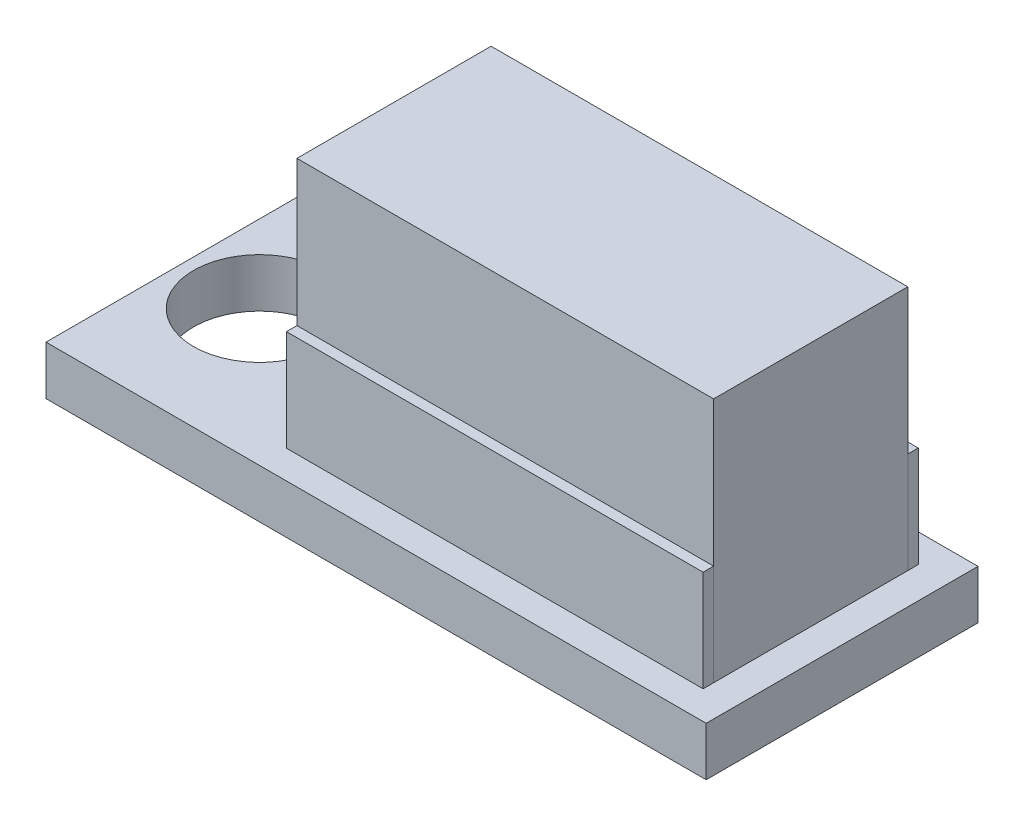
from build123d import *

# Parameters (mm, degrees)
SKETCH1_W           = 21.59
SKETCH1_H           = 8.89
SKETCH1_R           = 2.159
BOSS_EXTRUDE1_DEPTH = 1.6002
SKETCH2_W           = 13.6271
SKETCH2_H           = 7.0358
BOSS_EXTRUDE2_DEPTH = 4.9022
SKETCH3_W           = 13.6271
SKETCH3_H           = 6.35
BOSS_EXTRUDE3_DEPTH = 9.6393


with BuildPart() as part:
    # Sketch1 → Boss-Extrude1 (new body)
    with BuildSketch(Plane(origin=(0, 0, 0), x_dir=(1, 0, 0), z_dir=(0, 1, 0))):
        with Locations((-40.899991391, -20.536497471)):
            Rectangle(SKETCH1_W, SKETCH1_H)
        with Locations(Location((-49.154991391, -20.536497471, 0), (0, 0, 270))):
            Circle(SKETCH1_R, mode=Mode.SUBTRACT)
    extrude(amount=BOSS_EXTRUDE1_DEPTH)

    # Sketch2 → Boss-Extrude2 (add)
    with BuildSketch(Plane(origin=(0, 0, 0), x_dir=(1, 0, 0), z_dir=(0, 1, 0))):
        with Locations((-37.945014507, -20.536497471)):
            Rectangle(SKETCH2_W, SKETCH2_H)
    extrude(amount=BOSS_EXTRUDE2_DEPTH)


with BuildPart() as body_2:
    # Sketch3 → Boss-Extrude3 (new body)
    with BuildSketch(Plane(origin=(0, 0, 0), x_dir=(1, 0, 0), z_dir=(0, 1, 0))):
        with Locations((-37.945014507, -20.536497471)):
            Rectangle(SKETCH3_W, SKETCH3_H)
    extrude(amount=BOSS_EXTRUDE3_DEPTH)


solid = Compound([part.part, body_2.part])
